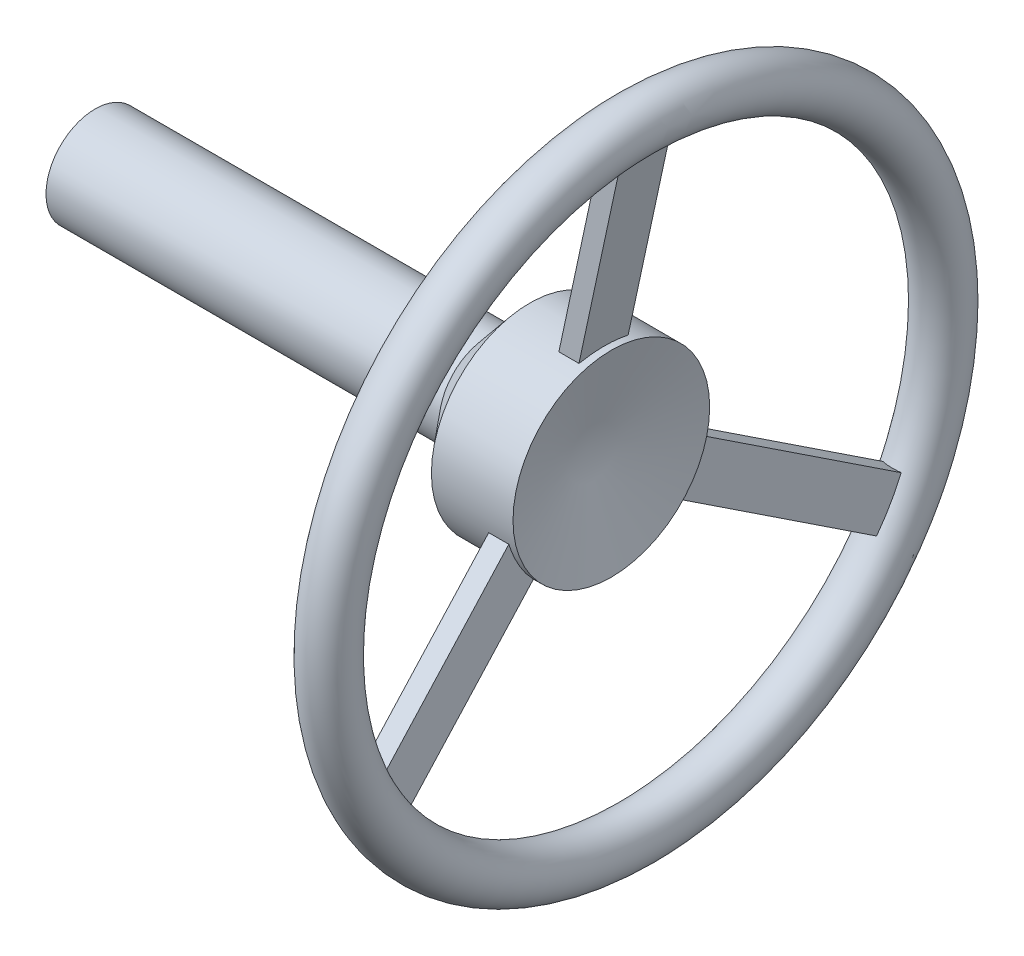
from build123d import *

# Parameters (mm, degrees)
SKETCH2_R           = 2.5
BOSS_EXTRUDE1_DEPTH = 2.5
CIRPATTERN1_COUNT   = 3


with BuildPart() as part:
    # Sketch1 → Revolve1 (revolve)
    with BuildSketch(Plane.XY, mode=Mode.PRIVATE) as revolve1_sk:
        Polygon((49.97067965, 0), (52.495498156, 10), (44.195498156, 10), (40, 5), (0, 5), (0, 0), align=None)
    revolve(revolve1_sk.sketch.rotate(Axis((-81.869594145, 0, 0), (1, 0, 0)), 90), axis=Axis((-81.869594145, 0, 0), (1, 0, 0)))



with BuildPart() as body_2:
    # Sketch2 → Revolve2 (revolve)
    with BuildSketch(Plane.XY, mode=Mode.PRIVATE) as revolve2_sk:
        with Locations((55, 31.25)):
            Circle(SKETCH2_R)
    revolve(revolve2_sk.sketch.rotate(Axis((0, 0, 0), (1, 0, 0)), 270), axis=Axis((0, 0, 0), (1, 0, 0)))


with BuildPart() as part_1:
    add(part.part)

    add(body_2.part)  # Boss-Extrude1 merges body 2
    # Sketch3 → Boss-Extrude1 (add, symmetric)
    with BuildSketch(Plane.XY):
        Polygon((51.6, 9.2), (49.554391748, 9.2), (53.974391748, 29.779681075), (56.02, 29.779681075), align=None)
    boss_extrude1 = extrude(amount=BOSS_EXTRUDE1_DEPTH, both=True)

    # CirPattern1: Boss-Extrude1 ×3 about axis
    cirpattern1_axis = Axis((0, 0, 0), (1, 0, 0))
    for i in range(1, CIRPATTERN1_COUNT):
        add(boss_extrude1.rotate(cirpattern1_axis, i * 360 / CIRPATTERN1_COUNT))


solid = part_1.part
